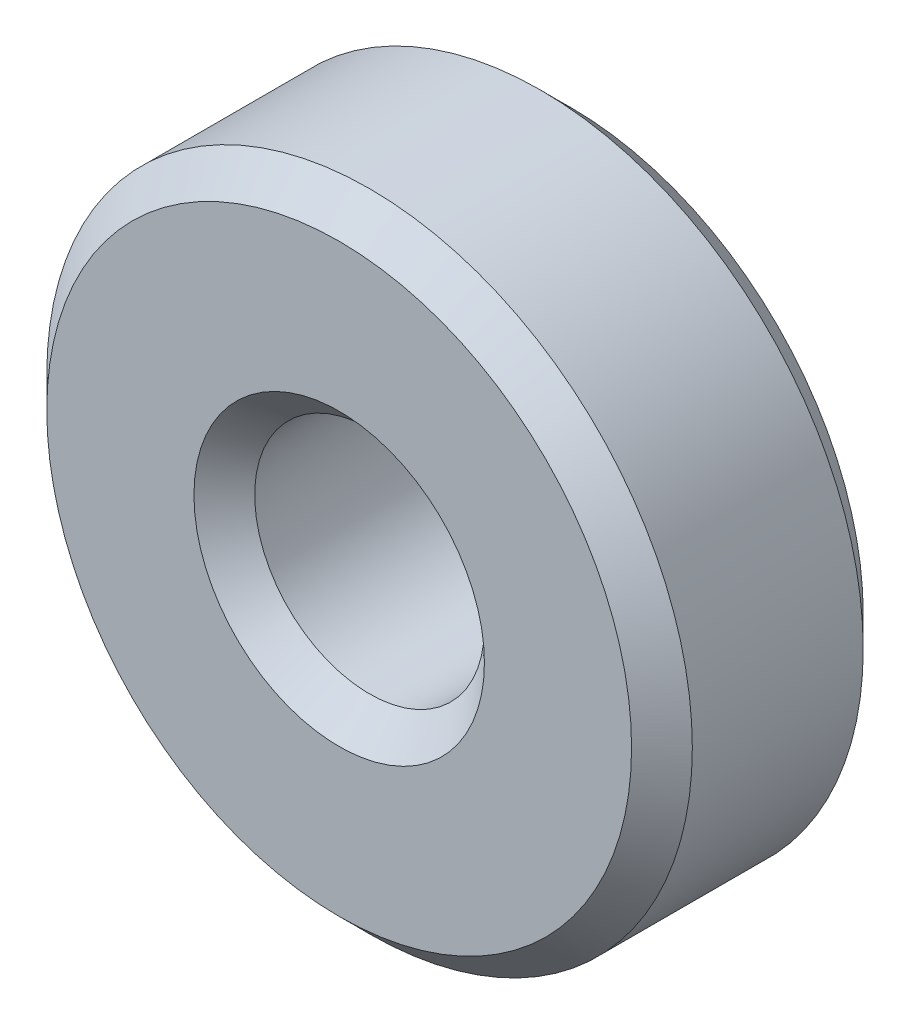
from build123d import *

# Parameters (mm, degrees)
SKETCH1_R           = 8.5
SKETCH1_R_2         = 3.025
BOSS_EXTRUDE1_DEPTH = 3.05
CHAMFER1_SIZE       = 0.8


with BuildPart() as part:
    # Sketch1 → Boss-Extrude1 (new, symmetric)
    with BuildSketch(Plane.XY):
        Circle(SKETCH1_R)
        Circle(SKETCH1_R_2, mode=Mode.SUBTRACT)
    extrude(amount=BOSS_EXTRUDE1_DEPTH, both=True)

    # Chamfer1
    chamfer1_edges = [part.edges().sort_by_distance(p)[0] for p in [
        (-8.5, 0, -3.05),
        (-8.5, 0, 3.05),
        (-3.025, 0, -3.05),
        (-3.025, 0, 3.05),
    ]]
    chamfer(chamfer1_edges, length=CHAMFER1_SIZE)


solid = part.part
